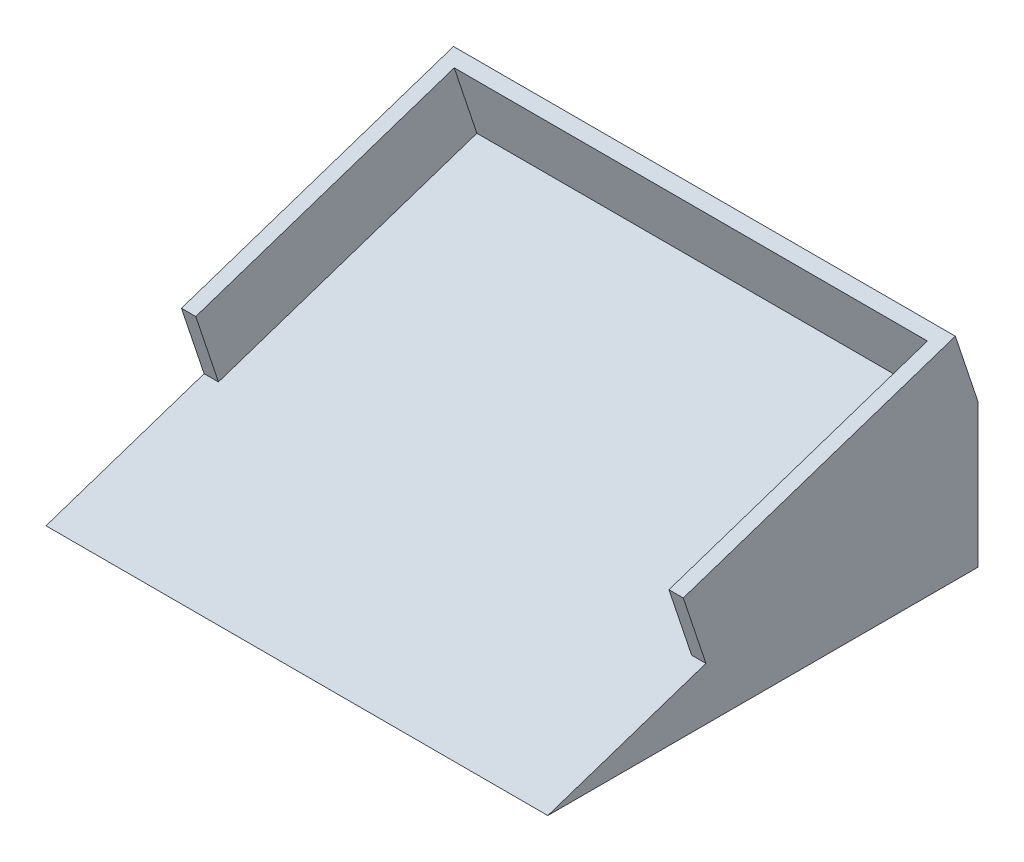
from build123d import *

# Parameters (mm, degrees)
SKETCH1_W           = 88.9
SKETCH1_H           = 76.2
BOSS_EXTRUDE1_DEPTH = 25.4
CUT_EXTRUDE1_DEPTH  = 120.811560377
BOSS_EXTRUDE2_DEPTH = 12.7


with BuildPart() as part:
    # Sketch1 → Boss-Extrude1 (new body)
    with BuildSketch(Plane(origin=(0, 0, 0), x_dir=(1, 0, 0), z_dir=(0, 1, 0))):
        with Locations((44.45, 38.1)):
            Rectangle(SKETCH1_W, SKETCH1_H)
    extrude(amount=BOSS_EXTRUDE1_DEPTH)

    # Sketch2 → Cut-Extrude1 (cut, through all)
    with BuildSketch(Plane(origin=(88.9, 0, 0), x_dir=(0, 0, -1), z_dir=(1, 0, 0))):
        Polygon((76.2, 25.4), (0, 0), (0, 25.4), align=None)
    extrude(amount=-CUT_EXTRUDE1_DEPTH, mode=Mode.SUBTRACT)

    # Sketch3 → Boss-Extrude2 (add)
    with BuildSketch(Plane(origin=(0, 0, 0), x_dir=(1, 0, 0), z_dir=(0, 0.9486832980505139, 0.3162277660168379))):
        Polygon((0, 29.521852568), (2.54, 29.521852568), (2.54, 77.781852568), (86.36, 77.781852568), (86.36, 29.521852568), (88.9, 29.521852568), (88.9, 80.321852568), (0, 80.321852568), align=None)
    extrude(amount=BOSS_EXTRUDE2_DEPTH)


solid = part.part
